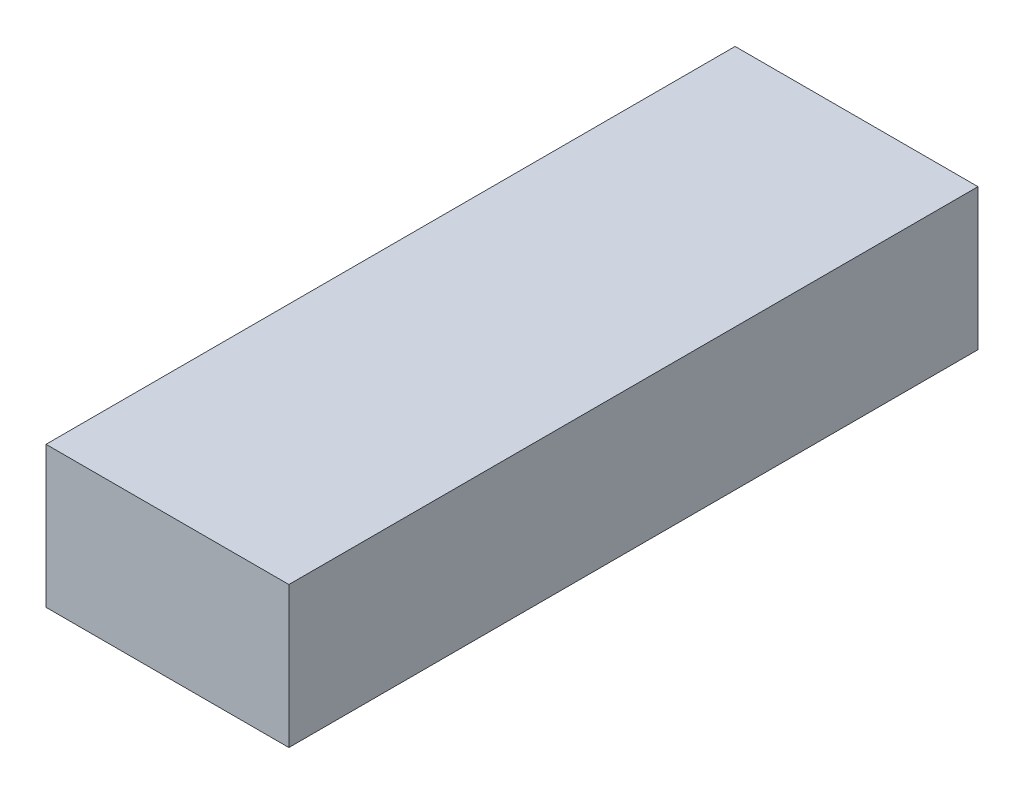
from build123d import *

# Parameters (mm, degrees)
EXTRUDE1_DEPTH      = 55
EXTRUDE1_DEPTH_BACK = 67
SKETCH1_W           = 43
SKETCH1_H           = 25


with BuildPart() as part:
    # Sketch1 → Extrude1 (new, two sides: drawn at the far end of the back side and taken through both)
    with BuildSketch(Plane.XY.offset(-EXTRUDE1_DEPTH_BACK)):
        with Locations((1, 1)):
            Rectangle(SKETCH1_W, SKETCH1_H)
    extrude(amount=EXTRUDE1_DEPTH + EXTRUDE1_DEPTH_BACK)


solid = part.part
